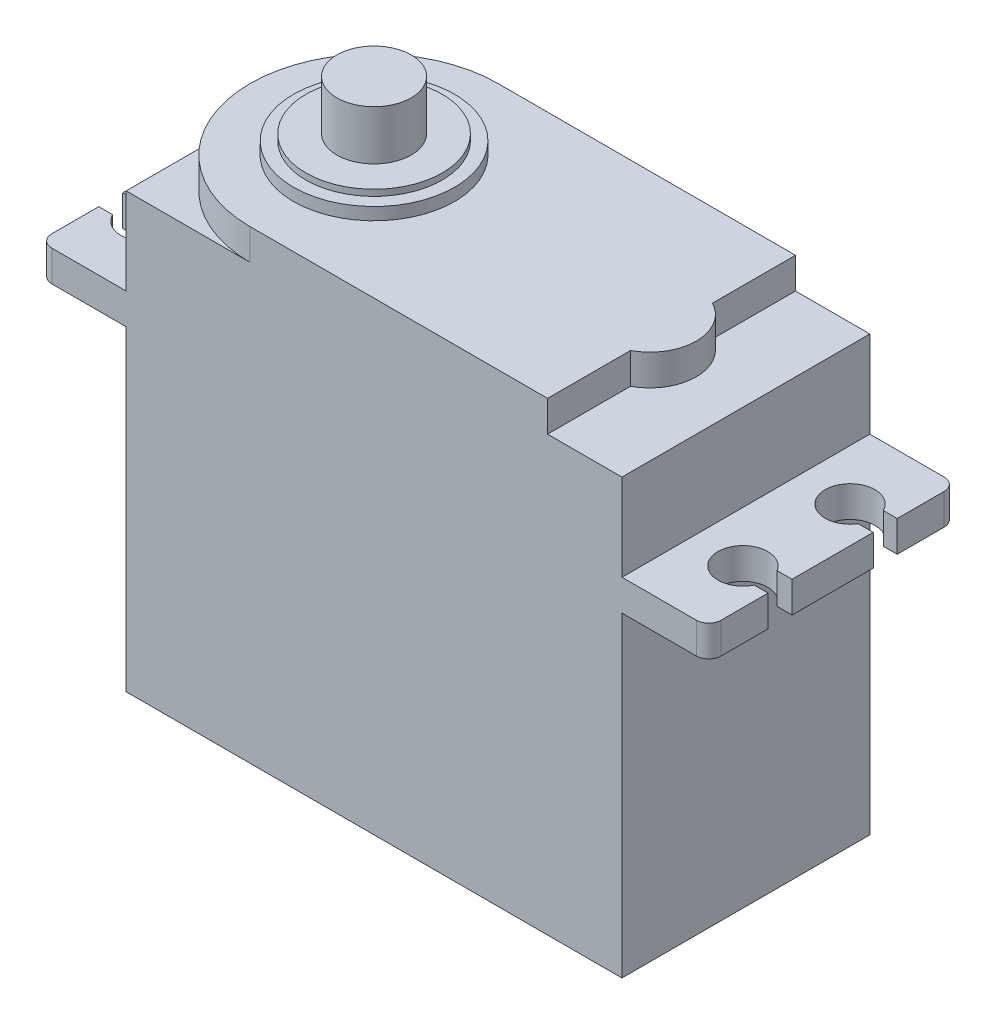
from build123d import *

# Parameters (mm, degrees)
SKETCH_1_W             = 40
SKETCH_1_H             = 20
EXTRUDE_1_DEPTH        = 37
SKETCH_2_W             = 20
SKETCH_2_H             = 2.5
EXTRUDE_2_DEPTH        = 7
FILLET_1_R             = 1
CUT_EXTRUDE_1_DEPTH    = 47
FILLET_1_OF_MIRROR_1_R = 1
EXTRUDE_3_DEPTH        = 2.5
SKETCH_6_R             = 6.5
EXTRUDE_4_DEPTH        = 3.5
SKETCH_7_R             = 5.5
EXTRUDE_5_DEPTH        = 4
SKETCH_8_R             = 3
EXTRUDE_6_DEPTH        = 8
CHAMFER_1_SIZE         = 2


with BuildPart() as part:
    # 草图1 → 凸台-拉伸1 (new body)
    with BuildSketch(Plane(origin=(0, 0, 0), x_dir=(1, 0, 0), z_dir=(0, 1, 0))):
        Rectangle(SKETCH_1_W, SKETCH_1_H)
    extrude(amount=EXTRUDE_1_DEPTH)

    # 草图2 → 凸台-拉伸2 (add)
    with BuildSketch(Plane(origin=(20, 0, 0), x_dir=(0, 0, -1), z_dir=(1, 0, 0))):
        with Locations((0, 28.75)):
            Rectangle(SKETCH_2_W, SKETCH_2_H)
    extrude_2 = extrude(amount=EXTRUDE_2_DEPTH)

    # 圆角1
    fillet_1_edges = [part.edges().sort_by_distance(p)[0] for p in [
        (27, 28.75, -10),
        (27, 28.75, 10),
    ]]
    fillet(fillet_1_edges, radius=FILLET_1_R)

    # 草图3 → 切除-拉伸1 (cut)
    with BuildSketch(Plane(origin=(0, 0, 0), x_dir=(1, 0, 0), z_dir=(0, 1, 0))):
        with BuildLine():
            Line((25.882021082, 5.209730705), (27, 5.209730705))
            Line((27, 5.209730705), (27, 3.27640675))
            Line((27, 3.27640675), (25.792986763, 3.27640675))
            ThreePointArc((25.792986763, 3.27640675), (22.077686149, 4.416217577), (25.882021082, 5.209730705))
        make_face()
        with BuildLine():
            Line((27, -3.27640675), (25.792986763, -3.27640675))
            ThreePointArc((25.792986763, -3.27640675), (22.077686149, -4.416217577), (25.882021082, -5.209730705))
            Line((25.882021082, -5.209730705), (27, -5.209730705))
            Line((27, -5.209730705), (27, -3.27640675))
        make_face()
    cut_extrude_1 = extrude(amount=CUT_EXTRUDE_1_DEPTH, mode=Mode.SUBTRACT)

    # 镜向1: 凸台-拉伸2, 切除-拉伸1 across plane
    add(extrude_2.mirror(Plane(origin=(0, 0, 0), x_dir=(0, 0, 1), z_dir=(1, 0, 0))))
    add(cut_extrude_1.mirror(Plane(origin=(0, 0, 0), x_dir=(0, 0, 1), z_dir=(1, 0, 0))), mode=Mode.SUBTRACT)

    # 圆角1 of 镜向1
    fillet_1_of_mirror_1_edges = [part.edges().sort_by_distance(p)[0] for p in [
        (-27, 28.75, -10),
        (-27, 28.75, 10),
    ]]
    fillet(fillet_1_of_mirror_1_edges, radius=FILLET_1_OF_MIRROR_1_R)

    # 草图4 → 凸台-拉伸3 (add)
    with BuildSketch(Plane(origin=(0, 37, 0), x_dir=(1, 0, 0), z_dir=(0, 1, 0))):
        with BuildLine():
            Line((14, 10), (14, 3.303949568))
            ThreePointArc((14, 3.303949568), (15.996871366, 0), (14, -3.303949568))
            Line((14, -3.303949568), (14, -10))
            Line((14, -10), (-10, -10))
            ThreePointArc((-10, -10), (-20, 0), (-10, 10))
            Line((-10, 10), (14, 10))
        make_face()
    extrude(amount=EXTRUDE_3_DEPTH)

    # 草图6 → 凸台-拉伸4 (add)
    with BuildSketch(Plane(origin=(0, 37, 0), x_dir=(1, 0, 0), z_dir=(0, 1, 0))):
        with Locations(Location((-10, 0, 0), (0, 0, 270))):
            Circle(SKETCH_6_R)
    extrude(amount=EXTRUDE_4_DEPTH)

    # 草图7 → 凸台-拉伸5 (add)
    with BuildSketch(Plane(origin=(0, 37, 0), x_dir=(1, 0, 0), z_dir=(0, 1, 0))):
        with Locations(Location((-10, 0, 0), (0, 0, 270))):
            Circle(SKETCH_7_R)
    extrude(amount=EXTRUDE_5_DEPTH)

    # 草图8 → 凸台-拉伸6 (add)
    with BuildSketch(Plane(origin=(0, 37, 0), x_dir=(1, 0, 0), z_dir=(0, 1, 0))):
        with Locations(Location((-10, 0, 0), (0, 0, 270))):
            Circle(SKETCH_8_R)
    extrude(amount=EXTRUDE_6_DEPTH)

    # 倒角1
    chamfer_1_edges = [part.edges().sort_by_distance(p)[0] for p in [
        (0, 0, 10),
        (-20, 0, 0),
        (0, 0, -10),
        (20, 0, 0),
    ]]
    chamfer(chamfer_1_edges, length=CHAMFER_1_SIZE)


solid = part.part
